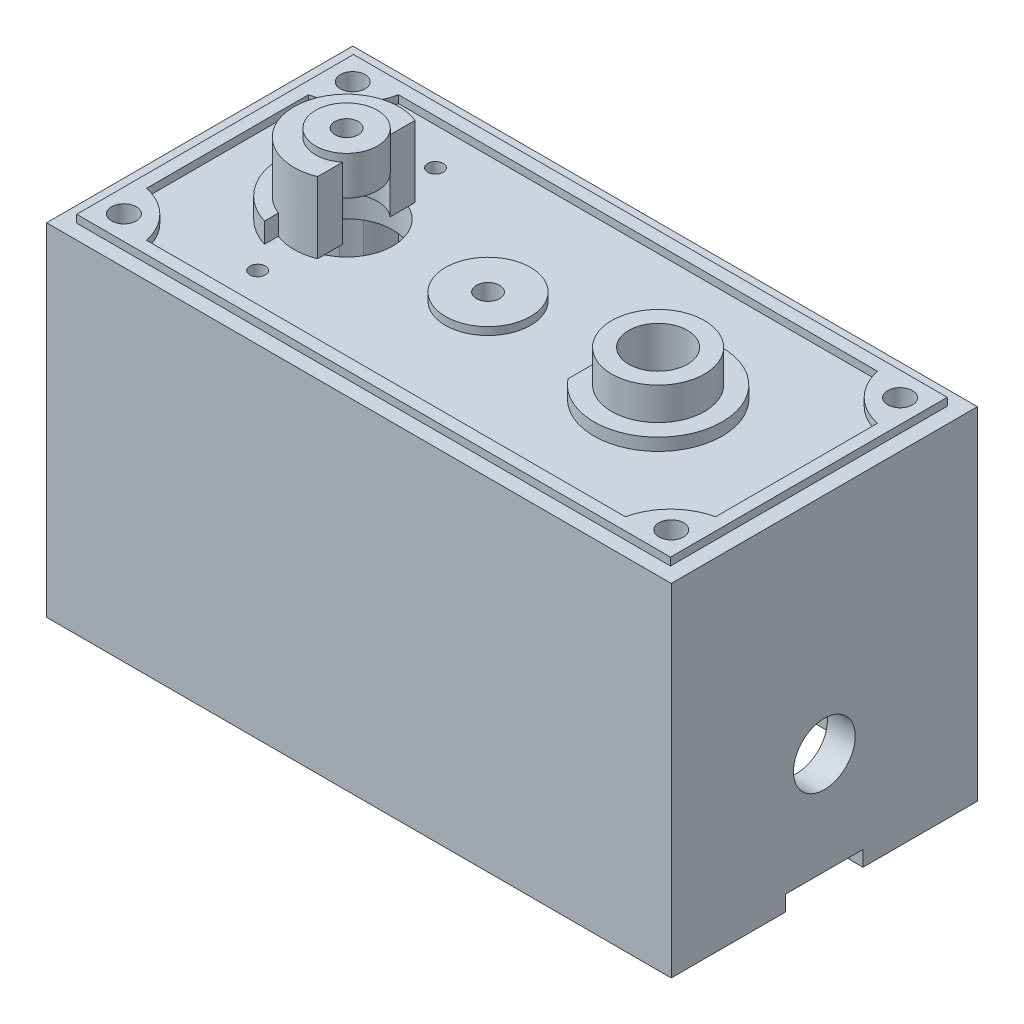
from build123d import *

# Parameters (mm, degrees)
SKETCH_1_W            = 40.4
SKETCH_1_H            = 21.6
EXTRUDE_1_DEPTH       = 19.8
SKETCH_3_W            = 38.4
SKETCH_3_H            = 17.9
EXTRUDE_2_DEPTH       = 1
SKETCH_4_W            = 40.4
SKETCH_4_H            = 19.8
EXTRUDE_3_DEPTH       = 0.5
SKETCH_5_R            = 2.75
EXTRUDE_4_DEPTH       = 0.5
EXTRUDE_5_DEPTH       = 0.8
SKETCH_7_R            = 3
EXTRUDE_6_DEPTH       = 2.1
SKETCH_8_R            = 1.9
CUT_EXTRUDE_7_DEPTH   = 38.750231787
SKETCH_10_R           = 0.75
CUT_EXTRUDE_10_DEPTH  = 2.7
EXTRUDE_11_DEPTH      = 1.3
SKETCH_13_R           = 3
CUT_EXTRUDE_13_DEPTH  = 37.710216562
EXTRUDE_START         = -1.3
EXTRUDE_14_DEPTH      = 4.6
SKETCH_14_R           = 2
CUT_EXTRUDE_15_DEPTH  = 39.896915045
EXTRUDE_16_DEPTH      = 0.5
EXTRUDE_16_DEPTH_BACK = 2
SKETCH_15_R           = 2
SKETCH_16_R           = 0.75
CUT_EXTRUDE_17_DEPTH  = 2.3
SKETCH_17_W           = 38.6
SKETCH_17_H           = 18
CUT_EXTRUDE_18_DEPTH  = 20
EXTRUDE_START_2       = 18
SKETCH_18_W           = 38.6
SKETCH_18_H           = 18
EXTRUDE_19_DEPTH      = 18
SKETCH_19_R           = 0.8
CUT_EXTRUDE_20_DEPTH  = 27.4
SKETCH_20_R           = 8.6
CUT_EXTRUDE_21_DEPTH  = 27.4
SKETCH_21_R           = 1.05
EXTRUDE_22_DEPTH      = 0.5
SKETCH_22_R           = 0.75
CUT_EXTRUDE_23_DEPTH  = 0.1
CUT_EXTRUDE_24_REACH  = 37.896
SKETCH_23_R           = 0.5
CUT_EXTRUDE_27_REACH  = 49.887
SKETCH_25_R           = 2
SKETCH_25_W           = 5
SKETCH_25_H           = 1


with BuildPart() as part:
    # 草圖1 → 伸長1 (new body)
    with BuildSketch(Plane.XY):
        Rectangle(SKETCH_1_W, SKETCH_1_H)
    extrude(amount=EXTRUDE_1_DEPTH)

    # 草圖3 → 伸長2 (add)
    with BuildSketch(Plane(origin=(0, 10.8, 0), x_dir=(1, 0, 0), z_dir=(0, 1, 0))):
        with Locations((0, -9.9)):
            Rectangle(SKETCH_3_W, SKETCH_3_H)
        with BuildLine():
            Line((-15.485164876, -1.75), (15.485164876, -1.75))
            ThreePointArc((15.485164876, -1.75), (16.512994231, -3.637005769), (18.4, -4.664835124))
            Line((18.4, -4.664835124), (18.4, -15.135164876))
            ThreePointArc((18.4, -15.135164876), (16.512994231, -16.162994231), (15.485164876, -18.05))
            Line((15.485164876, -18.05), (-15.485164876, -18.05))
            ThreePointArc((-15.485164876, -18.05), (-16.512994231, -16.162994231), (-18.4, -15.135164876))
            Line((-18.4, -15.135164876), (-18.4, -4.664835124))
            ThreePointArc((-18.4, -4.664835124), (-16.512994231, -3.637005769), (-15.485164876, -1.75))
        make_face(mode=Mode.SUBTRACT)
    extrude(amount=EXTRUDE_2_DEPTH)

    # 草圖4 → 伸長3 (add)
    with BuildSketch(Plane(origin=(0, 10.8, 0), x_dir=(1, 0, 0), z_dir=(0, 1, 0))):
        with Locations((0, -9.9)):
            Rectangle(SKETCH_4_W, SKETCH_4_H)
    extrude(amount=EXTRUDE_3_DEPTH)

    # 草圖5 → 伸長4 (add)
    with BuildSketch(Plane(origin=(0, 11.3, 0), x_dir=(1, 0, 0), z_dir=(0, 1, 0))):
        with Locations(Location((-1.55, -9.9, 0), (0, 0, 270))):
            Circle(SKETCH_5_R)
    extrude(amount=EXTRUDE_4_DEPTH)

    # 草圖6 → 伸長5 (add)
    with BuildSketch(Plane(origin=(0, 11.3, 0), x_dir=(1, 0, 0), z_dir=(0, 1, 0))):
        with BuildLine():
            Line((6.2, -7.31930242), (6.2, -12.48069758))
            ThreePointArc((6.2, -12.48069758), (13.6, -9.9), (6.2, -7.31930242))
        make_face()
    extrude(amount=EXTRUDE_5_DEPTH)

    # 草圖7 → 伸長6 (add)
    with BuildSketch(Plane(origin=(0, 12.1, 0), x_dir=(1, 0, 0), z_dir=(0, 1, 0))):
        with Locations(Location((9.45, -9.9, 0), (0, 0, 270))):
            Circle(SKETCH_7_R)
    extrude(amount=EXTRUDE_6_DEPTH)

    # 草圖8 → 伸長7 (cut, through all)
    with BuildSketch(Plane(origin=(0, 14.2, 0), x_dir=(1, 0, 0), z_dir=(0, 1, 0))):
        with Locations(Location((9.45, -9.9, 0), (0, 0, 270))):
            Circle(SKETCH_8_R)
    extrude(amount=-CUT_EXTRUDE_7_DEPTH, mode=Mode.SUBTRACT)

    # 草圖10 → 伸長10 (cut)
    with BuildSketch(Plane(origin=(0, 11.8, 0), x_dir=(1, 0, 0), z_dir=(0, 1, 0))):
        with Locations(Location((-1.55, -9.9, 0), (0, 0, 270))):
            Circle(SKETCH_10_R)
    extrude(amount=-CUT_EXTRUDE_10_DEPTH, mode=Mode.SUBTRACT)

    # 草圖11 → 伸長11 (add)
    with BuildSketch(Plane(origin=(0, 11.3, 0), x_dir=(1, 0, 0), z_dir=(0, 1, 0))):
        with BuildLine():
            Line((-11.95, -5.837980798), (-11.95, -13.962019202))
            ThreePointArc((-11.95, -13.962019202), (-14.95, -9.9), (-11.95, -5.837980798))
        make_face()
    extrude(amount=EXTRUDE_11_DEPTH)

    # 草圖13 → 伸長13 (cut, through all)
    with BuildSketch(Plane(origin=(0, 12.6, 0), x_dir=(1, 0, 0), z_dir=(0, 1, 0))):
        with Locations(Location((-10.7, -9.9, 0), (0, 0, 270))):
            Circle(SKETCH_13_R)
    extrude(amount=-CUT_EXTRUDE_13_DEPTH, mode=Mode.SUBTRACT)

    # 草圖12 → 伸長14 (add)
    with BuildSketch(Plane(origin=(0, 12.6, 0), x_dir=(1, 0, 0), z_dir=(0, 1, 0)).offset(EXTRUDE_START)):
        with BuildLine():
            Line((-9.420351611, -6.75), (-9.420351611, -13.05))
            ThreePointArc((-9.420351611, -13.05), (-14.1, -9.9), (-9.420351611, -6.75))
        make_face()
    extrude(amount=EXTRUDE_14_DEPTH)

    # 草圖14 → 伸長15 (cut, through all)
    with BuildSketch(Plane(origin=(0, 15.9, 0), x_dir=(1, 0, 0), z_dir=(0, 1, 0))):
        with Locations((-10.7, -9.9)):
            Circle(SKETCH_14_R)
    extrude(amount=-CUT_EXTRUDE_15_DEPTH, mode=Mode.SUBTRACT)

    # 草圖15 → 伸長16 (add, two sides: drawn at the far end of the back side and taken through both)
    with BuildSketch(Plane(origin=(0, 15.9, 0), x_dir=(1, 0, 0), z_dir=(0, 1, 0)).offset(-EXTRUDE_16_DEPTH_BACK)):
        with Locations(Location((-10.7, -9.9, 0), (0, 0, 270))):
            Circle(SKETCH_15_R)
    extrude(amount=EXTRUDE_16_DEPTH + EXTRUDE_16_DEPTH_BACK)

    # 草圖16 → 伸長17 (cut)
    with BuildSketch(Plane(origin=(0, 16.4, 0), x_dir=(1, 0, 0), z_dir=(0, 1, 0))):
        with Locations(Location((-10.7, -9.9, 0), (0, 0, 270))):
            Circle(SKETCH_16_R)
    extrude(amount=-CUT_EXTRUDE_17_DEPTH, mode=Mode.SUBTRACT)

    # 草圖17 → 伸長18 (cut)
    with BuildSketch(Plane.XZ.offset(10.8)):
        with Locations((0, 9.9)):
            Rectangle(SKETCH_17_W, SKETCH_17_H)
    extrude(amount=-CUT_EXTRUDE_18_DEPTH, mode=Mode.SUBTRACT)

    # 草圖18 → 伸長19 (add)
    with BuildSketch(Plane.XZ.offset(-9.2).offset(EXTRUDE_START_2)):
        with Locations((0, 9.9)):
            Rectangle(SKETCH_18_W, SKETCH_18_H)
        with BuildLine():
            Line((15.485164876, 1.75), (-15.485164876, 1.75))
            ThreePointArc((-15.485164876, 1.75), (-16.512994231, 3.637005769), (-18.4, 4.664835124))
            Line((-18.4, 4.664835124), (-18.4, 15.135164876))
            ThreePointArc((-18.4, 15.135164876), (-16.512994231, 16.162994231), (-15.485164876, 18.05))
            Line((-15.485164876, 18.05), (15.485164876, 18.05))
            ThreePointArc((15.485164876, 18.05), (16.512994231, 16.162994231), (18.4, 15.135164876))
            Line((18.4, 15.135164876), (18.4, 4.664835124))
            ThreePointArc((18.4, 4.664835124), (16.512994231, 3.637005769), (15.485164876, 1.75))
        make_face(mode=Mode.SUBTRACT)
    extrude(amount=-EXTRUDE_19_DEPTH)

    # 草圖19 → 伸長20 (cut)
    with BuildSketch(Plane(origin=(0, 11.8, 0), x_dir=(1, 0, 0), z_dir=(0, 1, 0))):
        with Locations(Location((-17.7, -2.5, 0), (0, 0, 270))):
            Circle(SKETCH_19_R)
        with Locations(Location((17.7, -2.5, 0), (0, 0, 270))):
            Circle(SKETCH_19_R)
        with Locations(Location((17.7, -17.3, 0), (0, 0, 270))):
            Circle(SKETCH_19_R)
        with Locations(Location((-17.7, -17.3, 0), (0, 0, 270))):
            Circle(SKETCH_19_R)
    extrude(amount=-CUT_EXTRUDE_20_DEPTH, mode=Mode.SUBTRACT)

    # 草圖20 → 伸長21 (cut)
    with BuildSketch(Plane.XZ.offset(-9.2)):
        with Locations((-10.7, 9.9)):
            Circle(SKETCH_20_R)
    extrude(amount=CUT_EXTRUDE_21_DEPTH, mode=Mode.SUBTRACT)

    # 草圖21 → 伸長22 (add)
    with BuildSketch(Plane.XZ.offset(-9.2)):
        with Locations(Location((-1.55, 9.9, 0), (0, 0, 270))):
            Circle(SKETCH_21_R)
    extrude(amount=EXTRUDE_22_DEPTH)

    # 草圖22 → 伸長23 (cut)
    with BuildSketch(Plane(origin=(0, 9.2, 0), x_dir=(1, 0, 0), z_dir=(0, 1, 0))):
        with Locations(Location((-1.55, -9.9, 0), (0, 0, 270))):
            Circle(SKETCH_22_R)
    extrude(amount=-CUT_EXTRUDE_23_DEPTH, mode=Mode.SUBTRACT)

    # 草圖23 → 伸長24 (cut, up to next)
    with BuildSketch(Plane(origin=(0, 11.3, 0), x_dir=(1, 0, 0), z_dir=(0, 1, 0)), mode=Mode.PRIVATE) as cut_extrude_24_sk1:
        with Locations(Location((-10.7, -4.15, 0), (0, 0, 270))):
            Circle(SKETCH_23_R)
    cut_extrude_24_tool1 = extrude(cut_extrude_24_sk1.sketch, amount=-CUT_EXTRUDE_24_REACH, mode=Mode.PRIVATE) & part.part
    # 草圖23 → 伸長24 (cut, up to next)
    with BuildSketch(Plane(origin=(0, 11.3, 0), x_dir=(1, 0, 0), z_dir=(0, 1, 0)), mode=Mode.PRIVATE) as cut_extrude_24_sk2:
        with Locations(Location((-10.7, -15.65, 0), (0, 0, 270))):
            Circle(SKETCH_23_R)
    cut_extrude_24_tool2 = extrude(cut_extrude_24_sk2.sketch, amount=-CUT_EXTRUDE_24_REACH, mode=Mode.PRIVATE) & part.part
    add(cut_extrude_24_tool1.solids().sort_by_distance((-10.7, 11.3, 4.15))[0], mode=Mode.SUBTRACT)
    add(cut_extrude_24_tool2.solids().sort_by_distance((-10.7, 11.3, 15.65))[0], mode=Mode.SUBTRACT)

    # 伸長27: up to this face of the body (flat: up to its plane)
    cut_extrude_27_end = Plane(part.part.faces().sort_by_distance((18.4, 0.2, 9.9))[0])
    # 草圖25 → 伸長27 (cut, up to the picked face)
    with BuildSketch(Plane(origin=(20.2, 0, 0), x_dir=(0, 0, -1), z_dir=(1, 0, 0)), mode=Mode.PRIVATE) as cut_extrude_27_sk1:
        with Locations(Location((-9.9, -3.2, 0), (0, 0, 90))):
            Circle(SKETCH_25_R)
    cut_extrude_27_tool1 = split(extrude(cut_extrude_27_sk1.sketch, amount=-CUT_EXTRUDE_27_REACH, mode=Mode.PRIVATE), bisect_by=cut_extrude_27_end, keep=Keep.BOTH, mode=Mode.PRIVATE)
    # 草圖25 → 伸長27 (cut, up to the picked face)
    with BuildSketch(Plane(origin=(20.2, 0, 0), x_dir=(0, 0, -1), z_dir=(1, 0, 0)), mode=Mode.PRIVATE) as cut_extrude_27_sk2:
        with Locations((-9.9, -10.3)):
            Rectangle(SKETCH_25_W, SKETCH_25_H)
    cut_extrude_27_tool2 = split(extrude(cut_extrude_27_sk2.sketch, amount=-CUT_EXTRUDE_27_REACH, mode=Mode.PRIVATE), bisect_by=cut_extrude_27_end, keep=Keep.BOTH, mode=Mode.PRIVATE)
    add(cut_extrude_27_tool1.solids().sort_by(Axis((20.2, -3.2, 9.9), (-1, 0, 0)))[0], mode=Mode.SUBTRACT)
    add(cut_extrude_27_tool2.solids().sort_by(Axis((20.2, -10.3, 9.9), (-1, 0, 0)))[0], mode=Mode.SUBTRACT)


solid = part.part
